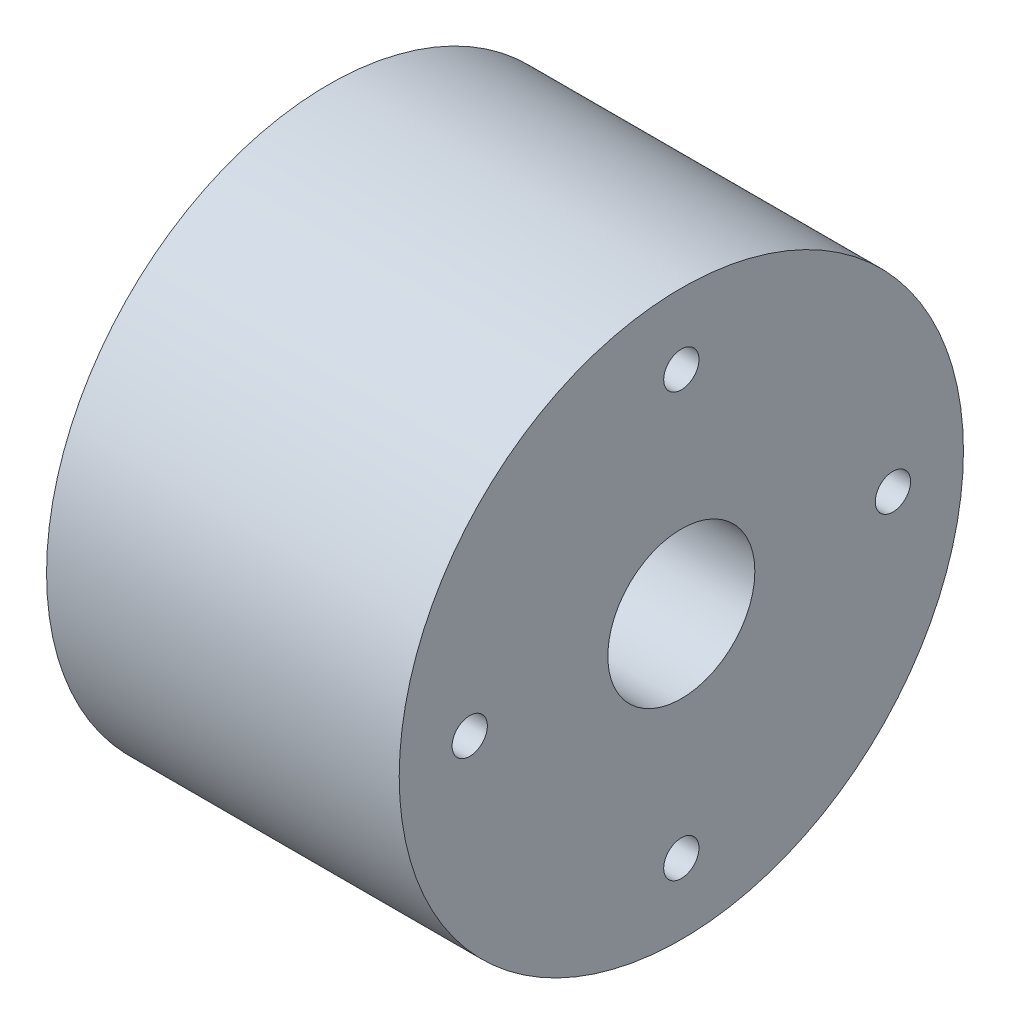
from build123d import *

# Parameters (mm, degrees)
SKETCH1_R                      = 40
BOSS_EXTRUDE1_DEPTH            = 50
SKETCH2_R                      = 10.425
CUT_EXTRUDE1_DEPTH             = 30
SKETCH3_R                      = 20
SKETCH3_R_2                    = 10
CUT_EXTRUDE2_DEPTH             = 5
SKETCH5_R                      = 2.5
CUT_EXTRUDE4_DEPTH             = 76.498344353
SKETCH4_R                      = 0.5
CUT_EXTRUDE6_DEPTH             = 76.498344353
CUT_EXTRUDE7_REACH             = 77.498
SKETCH7_R                      = 1.25
CUT_EXTRUDE7_DIRECTION_2_REACH = 77.498


with BuildPart() as part:
    # Sketch1 → Boss-Extrude1 (new body)
    with BuildSketch(Plane(origin=(0, 0, 0), x_dir=(0, 0, -1), z_dir=(1, 0, 0))):
        Circle(SKETCH1_R)
    extrude(amount=BOSS_EXTRUDE1_DEPTH)

    # Sketch2 → Cut-Extrude1 (cut)
    with BuildSketch(Plane(origin=(50, 0, 0), x_dir=(0, 0, -1), z_dir=(1, 0, 0))):
        Circle(SKETCH2_R)
    extrude(amount=-CUT_EXTRUDE1_DEPTH, mode=Mode.SUBTRACT)

    # Sketch3 → Cut-Extrude2 (cut)
    with BuildSketch(Plane.ZY):
        Circle(SKETCH3_R)
        Circle(SKETCH3_R_2, mode=Mode.SUBTRACT)
    extrude(amount=-CUT_EXTRUDE2_DEPTH, mode=Mode.SUBTRACT)

    # Sketch5 → Cut-Extrude4 (cut, through all)
    with BuildSketch(Plane.ZY):
        with Locations((0, 30)):
            Circle(SKETCH5_R)
        with Locations((30, 0)):
            Circle(SKETCH5_R)
        with Locations((0, -30)):
            Circle(SKETCH5_R)
        with Locations((-30, 0)):
            Circle(SKETCH5_R)
    extrude(amount=-CUT_EXTRUDE4_DEPTH, mode=Mode.SUBTRACT)

    # Sketch8 → Revolve4 (revolve)
    with BuildSketch(Plane.XY, mode=Mode.PRIVATE) as revolve4_sk:
        Polygon((27.456013161, 12.408889724), (20.184130796, 0.306445106), (19.15133868, 0.306445106), (19.15133868, 12.408889724), align=None)
    revolve(revolve4_sk.sketch.rotate(Axis((-60.024183688, 0, 0), (1, 0, 0)), 270), axis=Axis((-60.024183688, 0, 0), (1, 0, 0)))

    # Sketch4 → Cut-Extrude6 (cut, through all)
    with BuildSketch(Plane.ZY):
        Circle(SKETCH4_R)
    extrude(amount=-CUT_EXTRUDE6_DEPTH, mode=Mode.SUBTRACT)

    # Sketch7 → Cut-Extrude7 (cut, up to next)
    with BuildSketch(Plane(origin=(0, 0, 0), x_dir=(0, 0, 1), z_dir=(-0.9063077870366495, 0.4226182617407003, 0)), mode=Mode.PRIVATE) as cut_extrude7_sk1:
        with Locations(Location((0, 12.678547852, 0), (0, 0, 258.66668262))):
            Circle(SKETCH7_R)
    cut_extrude7_tool1 = extrude(cut_extrude7_sk1.sketch, amount=-CUT_EXTRUDE7_REACH, mode=Mode.PRIVATE) & part.part
    cut_extrude7 = cut_extrude7_tool1.solids().sort_by_distance((5.358186, 11.490667, 0))[0]
    add(cut_extrude7, mode=Mode.SUBTRACT)

    # Sketch7 → Cut-Extrude7 direction 2 (cut, up to next)
    with BuildSketch(Plane(origin=(0, 0, 0), x_dir=(0, 0, 1), z_dir=(-0.9063077870366495, 0.4226182617407003, 0)), mode=Mode.PRIVATE) as cut_extrude7_direction_2_sk1:
        with Locations(Location((0, 12.678547852, 0), (0, 0, 258.66668262))):
            Circle(SKETCH7_R)
    cut_extrude7_direction_2_tool1 = extrude(cut_extrude7_direction_2_sk1.sketch, amount=CUT_EXTRUDE7_DIRECTION_2_REACH, mode=Mode.PRIVATE) & part.part
    cut_extrude7_direction_2 = cut_extrude7_direction_2_tool1.solids().sort_by_distance((5.358186, 11.490667, 0))[0]
    add(cut_extrude7_direction_2, mode=Mode.SUBTRACT)

    # Mirror1: Cut-Extrude7, Cut-Extrude7 direction 2 across plane
    add(cut_extrude7.mirror(Plane.ZX), mode=Mode.SUBTRACT)
    add(cut_extrude7_direction_2.mirror(Plane.ZX), mode=Mode.SUBTRACT)


solid = part.part
